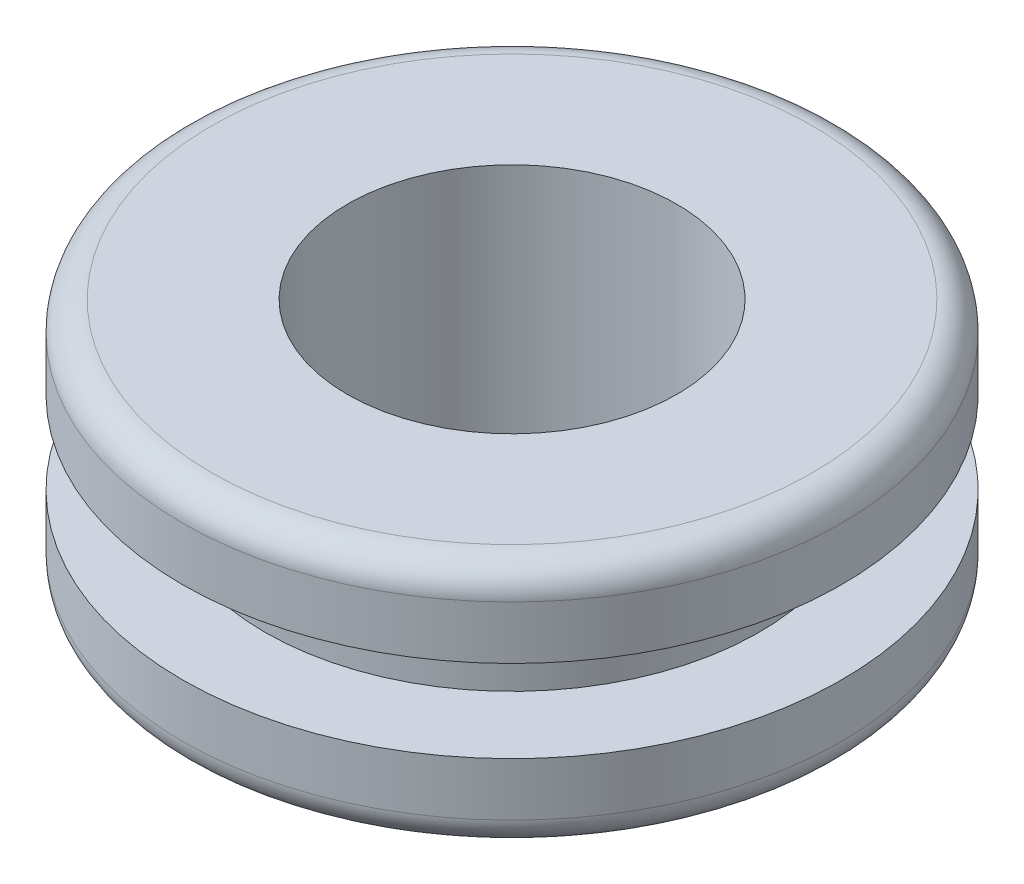
from build123d import *


with BuildPart() as part:
    # Sketch15 → Revolve4 (revolve)
    with BuildSketch(Plane.XY, mode=Mode.PRIVATE) as revolve4_sk:
        with BuildLine():
            Line((-3.175, -2.38125), (-3.175, 2.38125))
            Line((-3.175, 2.38125), (-5.788733992, 2.38125))
            ThreePointArc((-5.788733992, 2.38125), (-6.185608992, 2.216858992), (-6.35, 1.819983992))
            Line((-6.35, 1.819983992), (-6.35, 0.79375))
            Line((-6.35, 0.79375), (-4.7625, 0.79375))
            Line((-4.7625, 0.79375), (-4.7625, -0.79375))
            Line((-4.7625, -0.79375), (-6.35, -0.79375))
            Line((-6.35, -0.79375), (-6.35, -1.819983992))
            ThreePointArc((-6.35, -1.819983992), (-6.185608992, -2.216858992), (-5.788733992, -2.38125))
            Line((-5.788733992, -2.38125), (-3.175, -2.38125))
        make_face()
    revolve(revolve4_sk.sketch.rotate(Axis((0, -2.38125, 0), (0, 1, 0)), 90), axis=Axis((0, -2.38125, 0), (0, 1, 0)))


solid = part.part
